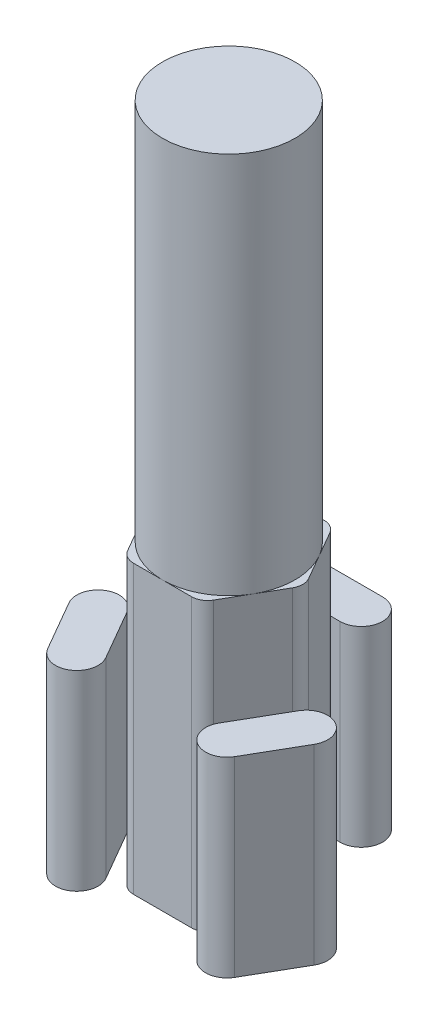
from build123d import *

# Parameters (mm, degrees)
BOSS_EXTRUDE5_DEPTH   = 0.9
BOSS_EXTRUDE5_2_DEPTH = 0.9
BOSS_EXTRUDE5_3_DEPTH = 0.9
BOSS_EXTRUDE5_4_DEPTH = 0.9
CUT_EXTRUDE2_START    = -0.3
CUT_EXTRUDE2_DEPTH    = 0.3
SKETCH5_R             = 0.207846097
BOSS_EXTRUDE6_DEPTH   = 1.2


with BuildPart() as part:
    # Sketch1 → Boss-Extrude5 (new body)
    with BuildSketch(Plane(origin=(0, 0, 0), x_dir=(1, 0, 0), z_dir=(0, 1, 0))):
        with BuildLine():
            Line((-0.091132487, 0.257846097), (0.091132487, 0.257846097))
            ThreePointArc((0.091132487, 0.257846097), (0.157927132, 0.324640742), (0.091132487, 0.391435388))
            Line((0.091132487, 0.391435388), (-0.091132487, 0.391435388))
            ThreePointArc((-0.091132487, 0.391435388), (-0.157927132, 0.324640742), (-0.091132487, 0.257846097))
        make_face()
    extrude(amount=BOSS_EXTRUDE5_DEPTH)


with BuildPart() as body_2:
    # Sketch1 → Boss-Extrude5 2 (new body)
    with BuildSketch(Plane(origin=(0, 0, 0), x_dir=(1, 0, 0), z_dir=(0, 1, 0))):
        with BuildLine():
            Line((-0.134433757, 0.182846097), (-0.225566243, 0.025))
            ThreePointArc((-0.225566243, 0.025), (-0.232264973, 0), (-0.225566243, -0.025))
            Line((-0.225566243, -0.025), (-0.134433757, -0.182846097))
            ThreePointArc((-0.134433757, -0.182846097), (-0.116132487, -0.201147367), (-0.091132487, -0.207846097))
            Line((-0.091132487, -0.207846097), (0.091132487, -0.207846097))
            ThreePointArc((0.091132487, -0.207846097), (0.116132487, -0.201147367), (0.134433757, -0.182846097))
            Line((0.134433757, -0.182846097), (0.225566243, -0.025))
            ThreePointArc((0.225566243, -0.025), (0.232264973, 0), (0.225566243, 0.025))
            Line((0.225566243, 0.025), (0.134433757, 0.182846097))
            ThreePointArc((0.134433757, 0.182846097), (0.116132487, 0.201147367), (0.091132487, 0.207846097))
            Line((0.091132487, 0.207846097), (-0.091132487, 0.207846097))
            ThreePointArc((-0.091132487, 0.207846097), (-0.116132487, 0.201147367), (-0.134433757, 0.182846097))
        make_face()
    extrude(amount=BOSS_EXTRUDE5_2_DEPTH)

    # Sketch5 → Boss-Extrude6 (add)
    with BuildSketch(Plane(origin=(0, 0.9, 0), x_dir=(1, 0, 0), z_dir=(0, 1, 0))):
        with Locations(Location((0, 0, 0), (0, 0, 270))):
            Circle(SKETCH5_R)
    extrude(amount=BOSS_EXTRUDE6_DEPTH)


with BuildPart() as body_3:
    # Sketch1 → Boss-Extrude5 3 (new body)
    with BuildSketch(Plane(origin=(0, 0, 0), x_dir=(1, 0, 0), z_dir=(0, 1, 0))):
        with BuildLine():
            Line((0.293426746, -0.274640742), (0.384559233, -0.116794645))
            ThreePointArc((0.384559233, -0.116794645), (0.360110696, -0.025551463), (0.268867513, -0.05))
            Line((0.268867513, -0.05), (0.177735027, -0.207846097))
            ThreePointArc((0.177735027, -0.207846097), (0.202183564, -0.299089279), (0.293426746, -0.274640742))
        make_face()
    extrude(amount=BOSS_EXTRUDE5_3_DEPTH)


with BuildPart() as body_4:
    # Sketch1 → Boss-Extrude5 4 (new body)
    with BuildSketch(Plane(origin=(0, 0, 0), x_dir=(1, 0, 0), z_dir=(0, 1, 0))):
        with BuildLine():
            Line((-0.384559233, -0.116794645), (-0.293426746, -0.274640742))
            ThreePointArc((-0.293426746, -0.274640742), (-0.202183564, -0.299089279), (-0.177735027, -0.207846097))
            Line((-0.177735027, -0.207846097), (-0.268867513, -0.05))
            ThreePointArc((-0.268867513, -0.05), (-0.360110696, -0.025551463), (-0.384559233, -0.116794645))
        make_face()
    extrude(amount=BOSS_EXTRUDE5_4_DEPTH)


with BuildPart() as cut_extrude2_tool:
    # Sketch4 → Cut-Extrude2 (new body)
    with BuildSketch(Plane(origin=(0, 0.9, 0), x_dir=(1, 0, 0), z_dir=(0, 1, 0)).offset(CUT_EXTRUDE2_START)):
        with BuildLine():
            Line((-0.091132487, 0.391435388), (0.091132487, 0.391435388))
            ThreePointArc((0.091132487, 0.391435388), (0.157927132, 0.324640742), (0.091132487, 0.257846097))
            Line((0.091132487, 0.257846097), (-0.091132487, 0.257846097))
            ThreePointArc((-0.091132487, 0.257846097), (-0.157927132, 0.324640742), (-0.091132487, 0.391435388))
        make_face()
        with BuildLine():
            Line((0.268867513, -0.05), (0.177735027, -0.207846097))
            ThreePointArc((0.177735027, -0.207846097), (0.202183564, -0.299089279), (0.293426746, -0.274640742))
            Line((0.293426746, -0.274640742), (0.384559233, -0.116794645))
            ThreePointArc((0.384559233, -0.116794645), (0.360110696, -0.025551463), (0.268867513, -0.05))
        make_face()
        with BuildLine():
            Line((-0.177735027, -0.207846097), (-0.268867513, -0.05))
            ThreePointArc((-0.268867513, -0.05), (-0.360110696, -0.025551463), (-0.384559233, -0.116794645))
            Line((-0.384559233, -0.116794645), (-0.293426746, -0.274640742))
            ThreePointArc((-0.293426746, -0.274640742), (-0.202183564, -0.299089279), (-0.177735027, -0.207846097))
        make_face()
    extrude(amount=CUT_EXTRUDE2_DEPTH)


with BuildPart() as part_1:
    add(part.part)

    # Cut-Extrude2: cut by cut_extrude2_tool
    add(cut_extrude2_tool.part, mode=Mode.SUBTRACT)


with BuildPart() as body_3_1:
    add(body_3.part)

    # Cut-Extrude2: cut by cut_extrude2_tool
    add(cut_extrude2_tool.part, mode=Mode.SUBTRACT)


with BuildPart() as body_4_1:
    add(body_4.part)

    # Cut-Extrude2: cut by cut_extrude2_tool
    add(cut_extrude2_tool.part, mode=Mode.SUBTRACT)


solid = Compound([body_2.part, part_1.part, body_3_1.part, body_4_1.part])
